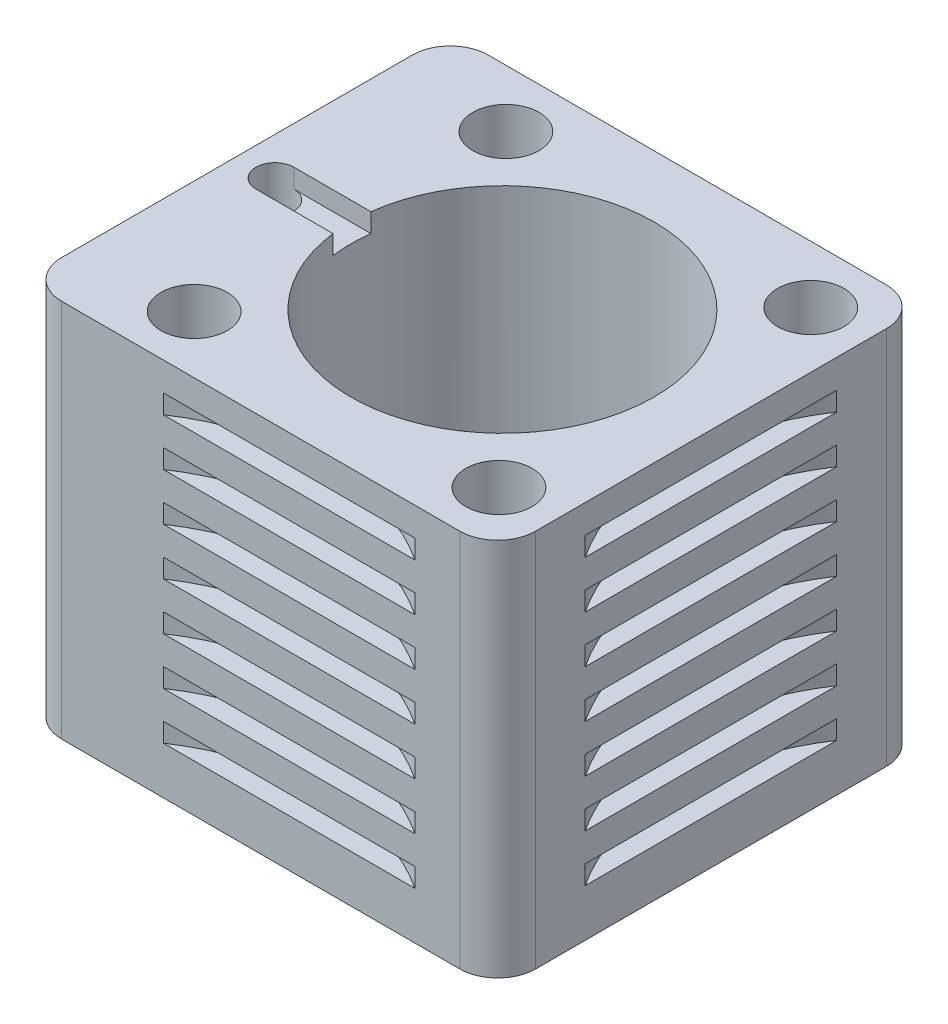
from build123d import *

# Parameters (mm, degrees)
SKETCH1_R           = 2
SKETCH1_R_2         = 3.5
SKETCH1_R_3         = 16
BOSS_EXTRUDE1_DEPTH = 20
CUT_EXTRUDE1_DEPTH  = 2
CUT_EXTRUDE2_START  = -3
CUT_EXTRUDE2_DEPTH  = 2
LPATTERN1_COUNT     = 7
LPATTERN1_PITCH     = 5
SKETCH2_R           = 18
SKETCH2_R_2         = 16
CUT_EXTRUDE3_DEPTH  = 2


with BuildPart() as part:
    # Sketch1 → Boss-Extrude1 (new, symmetric)
    with BuildSketch(Plane(origin=(0, 0, 0), x_dir=(1, 0, 0), z_dir=(0, 1, 0))):
        with BuildLine():
            Line((-22, 22.5), (-24, 22.5))
            ThreePointArc((-24, 22.5), (-26.828427125, 21.328427125), (-28, 18.5))
            Line((-28, 18.5), (-28, -18.5))
            ThreePointArc((-28, -18.5), (-26.828427125, -21.328427125), (-24, -22.5))
            Line((-24, -22.5), (-22, -22.5))
            Line((-22, -22.5), (18, -22.5))
            ThreePointArc((18, -22.5), (20.828427125, -21.328427125), (22, -18.5))
            Line((22, -18.5), (22, 18.5))
            ThreePointArc((22, 18.5), (20.828427125, 21.328427125), (18, 22.5))
            Line((18, 22.5), (-22, 22.5))
        make_face()
        with Locations(Location((-24, 0, 0), (0, 0, 270))):
            Circle(SKETCH1_R, mode=Mode.SUBTRACT)
        with Locations(Location((16.079705534, 16.445153387, 0), (0, 0, 270))):
            Circle(SKETCH1_R_2, mode=Mode.SUBTRACT)
        with Locations(Location((-16.079705534, 16.445153387, 0), (0, 0, 270))):
            Circle(SKETCH1_R_2, mode=Mode.SUBTRACT)
        with Locations(Location((-16.079705534, -16.445153387, 0), (0, 0, 270))):
            Circle(SKETCH1_R_2, mode=Mode.SUBTRACT)
        with Locations(Location((16.079705534, -16.445153387, 0), (0, 0, 270))):
            Circle(SKETCH1_R_2, mode=Mode.SUBTRACT)
        with Locations(Location((0, 0, 0), (0, 0, 270))):
            Circle(SKETCH1_R_3, mode=Mode.SUBTRACT)
    extrude(amount=BOSS_EXTRUDE1_DEPTH, both=True)

    # Sketch3 → Cut-Extrude1 (cut)
    with BuildSketch(Plane(origin=(0, 20, 0), x_dir=(1, 0, 0), z_dir=(0, 1, 0))):
        with BuildLine():
            Line((-24, 2), (-15.874507866, 2))
            ThreePointArc((-15.874507866, 2), (-16, 0), (-15.874507866, -2))
            Line((-15.874507866, -2), (-24, -2))
            ThreePointArc((-24, -2), (-22, 0), (-24, 2))
        make_face()
    extrude(amount=-CUT_EXTRUDE1_DEPTH, mode=Mode.SUBTRACT)

    # Sketch5 → Cut-Extrude2 (cut)
    with BuildSketch(Plane(origin=(0, 20, 0), x_dir=(1, 0, 0), z_dir=(0, 1, 0)).offset(CUT_EXTRUDE2_START)):
        with BuildLine():
            ThreePointArc((13.266499161, -22.5), (6.92820323, -19.521749414), (0, -18.5))
            Line((0, -18.5), (0, -22.5))
            Line((0, -22.5), (13.266499161, -22.5))
        make_face()
        with BuildLine():
            Line((0, -22.5), (0, -18.5))
            ThreePointArc((0, -18.5), (-6.92820323, -19.521749414), (-13.266499161, -22.5))
            Line((-13.266499161, -22.5), (0, -22.5))
        make_face()
        with BuildLine():
            Line((13.266499161, -22.5), (0, -22.5))
            Line((0, -22.5), (-13.266499161, -22.5))
            ThreePointArc((-13.266499161, -22.5), (-11.349097324, -63.647056295), (24, -42.5))
            ThreePointArc((24, -42.5), (21.147056295, -31.150902676), (13.266499161, -22.5))
        make_face()
        with BuildLine():
            ThreePointArc((18, 0), (19.021749414, -6.92820323), (22, -13.266499161))
            Line((22, -13.266499161), (22, 0))
            Line((22, 0), (18, 0))
        make_face()
        with BuildLine():
            Line((22, 0), (22, -13.266499161))
            ThreePointArc((22, -13.266499161), (48.92820323, -22.978250586), (66, 0))
            ThreePointArc((66, 0), (48.92820323, 22.978250586), (22, 13.266499161))
            Line((22, 13.266499161), (22, 0))
        make_face()
        with BuildLine():
            Line((18, 0), (22, 0))
            Line((22, 0), (22, 13.266499161))
            ThreePointArc((22, 13.266499161), (19.021749414, 6.92820323), (18, 0))
        make_face()
        with BuildLine():
            ThreePointArc((24, 42.5), (-11.349097324, 63.647056295), (-13.266499161, 22.5))
            Line((-13.266499161, 22.5), (0, 22.5))
            Line((0, 22.5), (13.266499161, 22.5))
            ThreePointArc((13.266499161, 22.5), (21.147056295, 31.150902676), (24, 42.5))
        make_face()
        with BuildLine():
            Line((0, 22.5), (-13.266499161, 22.5))
            ThreePointArc((-13.266499161, 22.5), (-6.92820323, 19.521749414), (0, 18.5))
            Line((0, 18.5), (0, 22.5))
        make_face()
        with BuildLine():
            Line((13.266499161, 22.5), (0, 22.5))
            Line((0, 22.5), (0, 18.5))
            ThreePointArc((0, 18.5), (6.92820323, 19.521749414), (13.266499161, 22.5))
        make_face()
    cut_extrude2 = extrude(amount=-CUT_EXTRUDE2_DEPTH, mode=Mode.SUBTRACT)

    # LPattern1: Cut-Extrude2 ×7
    with Locations(*[(0, -i * LPATTERN1_PITCH, 0) for i in range(1, LPATTERN1_COUNT)]):
        add(cut_extrude2, mode=Mode.SUBTRACT)

    # Sketch2 → Cut-Extrude3 (cut)
    with BuildSketch(Plane.XZ.offset(20)):
        with Locations(Location((0, 0, 0), (0, 0, 270))):
            Circle(SKETCH2_R)
        with Locations(Location((0, 0, 0), (0, 0, 270))):
            Circle(SKETCH2_R_2, mode=Mode.SUBTRACT)
    extrude(amount=-CUT_EXTRUDE3_DEPTH, mode=Mode.SUBTRACT)


solid = part.part
